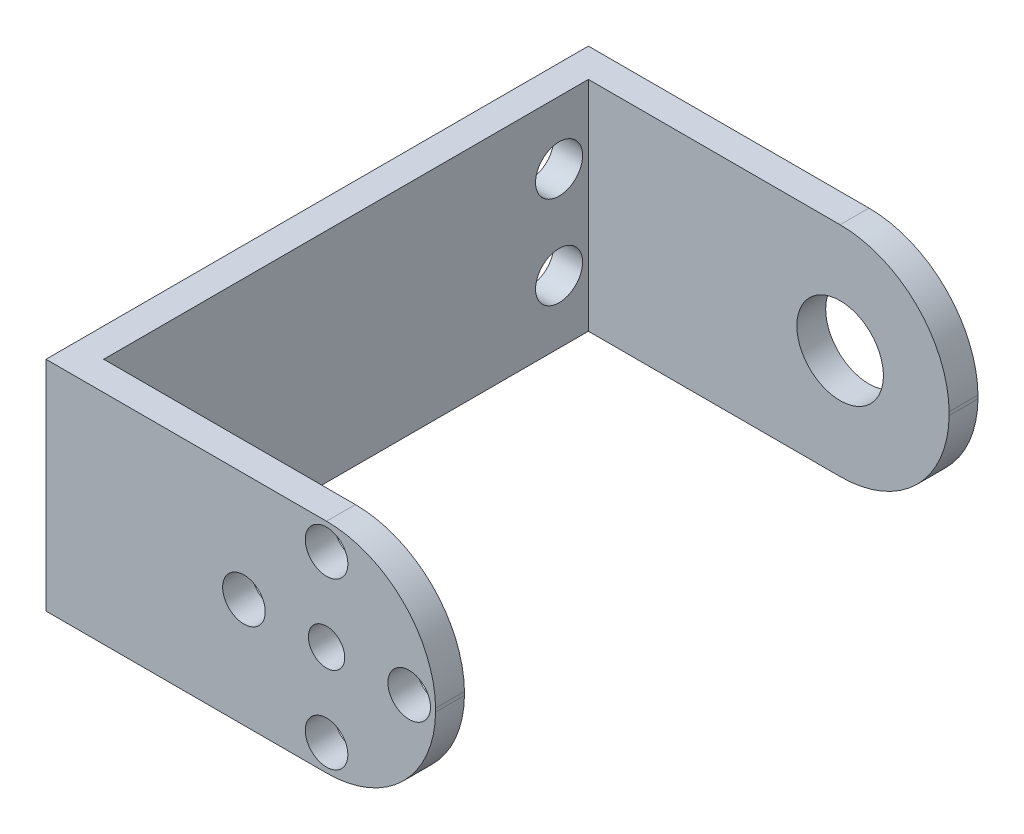
from build123d import *

# Parameters (mm, degrees)
BOSS_EXTRUDE1_DEPTH = 24.003
CUT_EXTRUDE1_DEPTH  = 68.813026147
CUT_EXTRUDE2_REACH  = 69.813
SKETCH3_R           = 2
SKETCH3_R_2         = 2.34315
CUT_EXTRUDE3_REACH  = 69.813
SKETCH4_R           = 4.7625
CUT_EXTRUDE4_REACH  = 59.49
SKETCH5_R           = 2.5868


with BuildPart() as part:
    # Sketch1 → Boss-Extrude1 (new body)
    with BuildSketch(Plane(origin=(0, 0, 0), x_dir=(1, 0, 0), z_dir=(0, 1, 0))):
        Polygon((-21.4375, -29.845), (21.4375, -29.845), (21.4375, -26.67), (-18.2625, -26.67), (-18.2625, 26.67), (21.4375, 26.67), (21.4375, 29.845), (-21.4375, 29.845), align=None)
    extrude(amount=BOSS_EXTRUDE1_DEPTH)

    # Sketch2 → Cut-Extrude1 (cut, through all)
    with BuildSketch(Plane.XY.offset(29.845)):
        with BuildLine():
            Line((112.499618931, 24.003), (15.0875, 24.003))
            Line((15.0875, 24.003), (9.4375, 24.003))
            ThreePointArc((9.4375, 24.003), (21.439, 12.0015), (9.4375, 0))
            Line((9.4375, 0), (15.0875, 0))
            Line((15.0875, 0), (112.499618931, 0))
            Line((112.499618931, 0), (307.323856793, 0))
            Line((307.323856793, 0), (307.323856793, 24.003))
            Line((307.323856793, 24.003), (112.499618931, 24.003))
        make_face()
    extrude(amount=-CUT_EXTRUDE1_DEPTH, mode=Mode.SUBTRACT)

    # Sketch3 → Cut-Extrude2 (cut, up to next)
    with BuildSketch(Plane.XY.offset(29.845), mode=Mode.PRIVATE) as cut_extrude2_sk1:
        with Locations((9.4375, 12.0015)):
            Circle(SKETCH3_R)
    cut_extrude2_tool1 = extrude(cut_extrude2_sk1.sketch, amount=-CUT_EXTRUDE2_REACH, mode=Mode.PRIVATE) & part.part
    # Sketch3 → Cut-Extrude2 (cut, up to next)
    with BuildSketch(Plane.XY.offset(29.845), mode=Mode.PRIVATE) as cut_extrude2_sk2:
        with Locations((9.4375, 21.0947)):
            Circle(SKETCH3_R_2)
    cut_extrude2_tool2 = extrude(cut_extrude2_sk2.sketch, amount=-CUT_EXTRUDE2_REACH, mode=Mode.PRIVATE) & part.part
    # Sketch3 → Cut-Extrude2 (cut, up to next)
    with BuildSketch(Plane.XY.offset(29.845), mode=Mode.PRIVATE) as cut_extrude2_sk3:
        with Locations((18.5307, 12.0015)):
            Circle(SKETCH3_R_2)
    cut_extrude2_tool3 = extrude(cut_extrude2_sk3.sketch, amount=-CUT_EXTRUDE2_REACH, mode=Mode.PRIVATE) & part.part
    # Sketch3 → Cut-Extrude2 (cut, up to next)
    with BuildSketch(Plane.XY.offset(29.845), mode=Mode.PRIVATE) as cut_extrude2_sk4:
        with Locations((9.4375, 2.9083)):
            Circle(SKETCH3_R_2)
    cut_extrude2_tool4 = extrude(cut_extrude2_sk4.sketch, amount=-CUT_EXTRUDE2_REACH, mode=Mode.PRIVATE) & part.part
    # Sketch3 → Cut-Extrude2 (cut, up to next)
    with BuildSketch(Plane.XY.offset(29.845), mode=Mode.PRIVATE) as cut_extrude2_sk5:
        with Locations((0.3443, 12.0015)):
            Circle(SKETCH3_R_2)
    cut_extrude2_tool5 = extrude(cut_extrude2_sk5.sketch, amount=-CUT_EXTRUDE2_REACH, mode=Mode.PRIVATE) & part.part
    add(cut_extrude2_tool1.solids().sort_by_distance((9.4375, 12.0015, 29.845))[0], mode=Mode.SUBTRACT)
    add(cut_extrude2_tool2.solids().sort_by_distance((9.4375, 21.0947, 29.845))[0], mode=Mode.SUBTRACT)
    add(cut_extrude2_tool3.solids().sort_by_distance((18.5307, 12.0015, 29.845))[0], mode=Mode.SUBTRACT)
    add(cut_extrude2_tool4.solids().sort_by_distance((9.4375, 2.9083, 29.845))[0], mode=Mode.SUBTRACT)
    add(cut_extrude2_tool5.solids().sort_by_distance((0.3443, 12.0015, 29.845))[0], mode=Mode.SUBTRACT)

    # Sketch4 → Cut-Extrude3 (cut, up to next)
    with BuildSketch(Plane(origin=(0, 0, -29.845), x_dir=(-1, 0, 0), z_dir=(0, 0, -1)), mode=Mode.PRIVATE) as cut_extrude3_sk1:
        with Locations((-9.4375, 12.0015)):
            Circle(SKETCH4_R)
    cut_extrude3_tool1 = extrude(cut_extrude3_sk1.sketch, amount=-CUT_EXTRUDE3_REACH, mode=Mode.PRIVATE) & part.part
    add(cut_extrude3_tool1.solids().sort_by_distance((9.4375, 12.0015, -29.845))[0], mode=Mode.SUBTRACT)

    # Sketch5 → Cut-Extrude4 (cut, up to next)
    with BuildSketch(Plane.ZY.offset(21.4375), mode=Mode.PRIVATE) as cut_extrude4_sk1:
        with Locations((-23.443, 17.0815)):
            Circle(SKETCH5_R)
    cut_extrude4_tool1 = extrude(cut_extrude4_sk1.sketch, amount=-CUT_EXTRUDE4_REACH, mode=Mode.PRIVATE) & part.part
    # Sketch5 → Cut-Extrude4 (cut, up to next)
    with BuildSketch(Plane.ZY.offset(21.4375), mode=Mode.PRIVATE) as cut_extrude4_sk2:
        with Locations((-23.443, 6.9215)):
            Circle(SKETCH5_R)
    cut_extrude4_tool2 = extrude(cut_extrude4_sk2.sketch, amount=-CUT_EXTRUDE4_REACH, mode=Mode.PRIVATE) & part.part
    # Sketch5 → Cut-Extrude4 (cut, up to next)
    with BuildSketch(Plane.ZY.offset(21.4375), mode=Mode.PRIVATE) as cut_extrude4_sk3:
        with Locations((23.443, 6.9215)):
            Circle(SKETCH5_R)
    cut_extrude4_tool3 = extrude(cut_extrude4_sk3.sketch, amount=-CUT_EXTRUDE4_REACH, mode=Mode.PRIVATE) & part.part
    # Sketch5 → Cut-Extrude4 (cut, up to next)
    with BuildSketch(Plane.ZY.offset(21.4375), mode=Mode.PRIVATE) as cut_extrude4_sk4:
        with Locations((23.443, 17.0815)):
            Circle(SKETCH5_R)
    cut_extrude4_tool4 = extrude(cut_extrude4_sk4.sketch, amount=-CUT_EXTRUDE4_REACH, mode=Mode.PRIVATE) & part.part
    add(cut_extrude4_tool1.solids().sort_by_distance((-21.4375, 17.0815, -23.443))[0], mode=Mode.SUBTRACT)
    add(cut_extrude4_tool2.solids().sort_by_distance((-21.4375, 6.9215, -23.443))[0], mode=Mode.SUBTRACT)
    add(cut_extrude4_tool3.solids().sort_by_distance((-21.4375, 6.9215, 23.443))[0], mode=Mode.SUBTRACT)
    add(cut_extrude4_tool4.solids().sort_by_distance((-21.4375, 17.0815, 23.443))[0], mode=Mode.SUBTRACT)


solid = part.part
